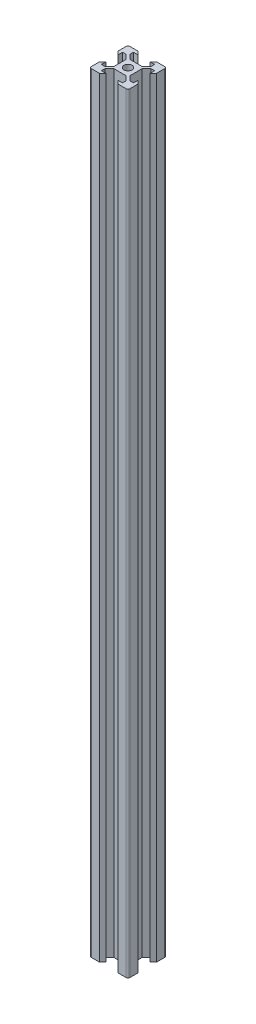
from build123d import *

# Parameters (mm, degrees)
MASTERLAYOUTSKETCH_R = 2.1
MAIN_EXTRUSION_DEPTH = 400
EDGE_FILLETS_R       = 1


with BuildPart() as part:
    # MasterLayoutSketch → Main Extrusion (new body)
    with BuildSketch(Plane(origin=(0, 0, 0), x_dir=(1, 0, 0), z_dir=(0, 1, 0))):
        Polygon((-8.325, 3.1), (-8.325, 5.5), (-6.560660172, 5.5), (-4.160660172, 3.1), (-4.160660172, -3.1), (-6.560660172, -5.5), (-8.325, -5.5), (-8.325, -3.1), (-10, -4.775), (-10, -10), (-4.775, -10), (-3.1, -8.325), (-5.5, -8.325), (-5.5, -6.560660172), (-3.1, -4.160660172), (3.1, -4.160660172), (5.5, -6.560660172), (5.5, -8.325), (3.1, -8.325), (4.775, -10), (10, -10), (10, -4.775), (8.325, -3.1), (8.325, -5.5), (6.560660172, -5.5), (4.160660172, -3.1), (4.160660172, 3.1), (6.560660172, 5.5), (8.325, 5.5), (8.325, 3.1), (10, 4.775), (10, 10), (4.775, 10), (3.1, 8.325), (5.5, 8.325), (5.5, 6.560660172), (3.1, 4.160660172), (-3.1, 4.160660172), (-5.5, 6.560660172), (-5.5, 8.325), (-3.1, 8.325), (-4.775, 10), (-10, 10), (-10, 4.775), align=None)
        with Locations(Location((0, 0, 0), (0, 0, 270))):
            Circle(MASTERLAYOUTSKETCH_R, mode=Mode.SUBTRACT)
    extrude(amount=MAIN_EXTRUSION_DEPTH)

    # Edge Fillets
    edge_fillets_edges = [part.edges().sort_by_distance(p)[0] for p in [
        (10, 200, -10),
        (10, 200, 10),
        (-10, 200, 10),
        (-10, 200, -10),
    ]]
    fillet(edge_fillets_edges, radius=EDGE_FILLETS_R)


solid = part.part
